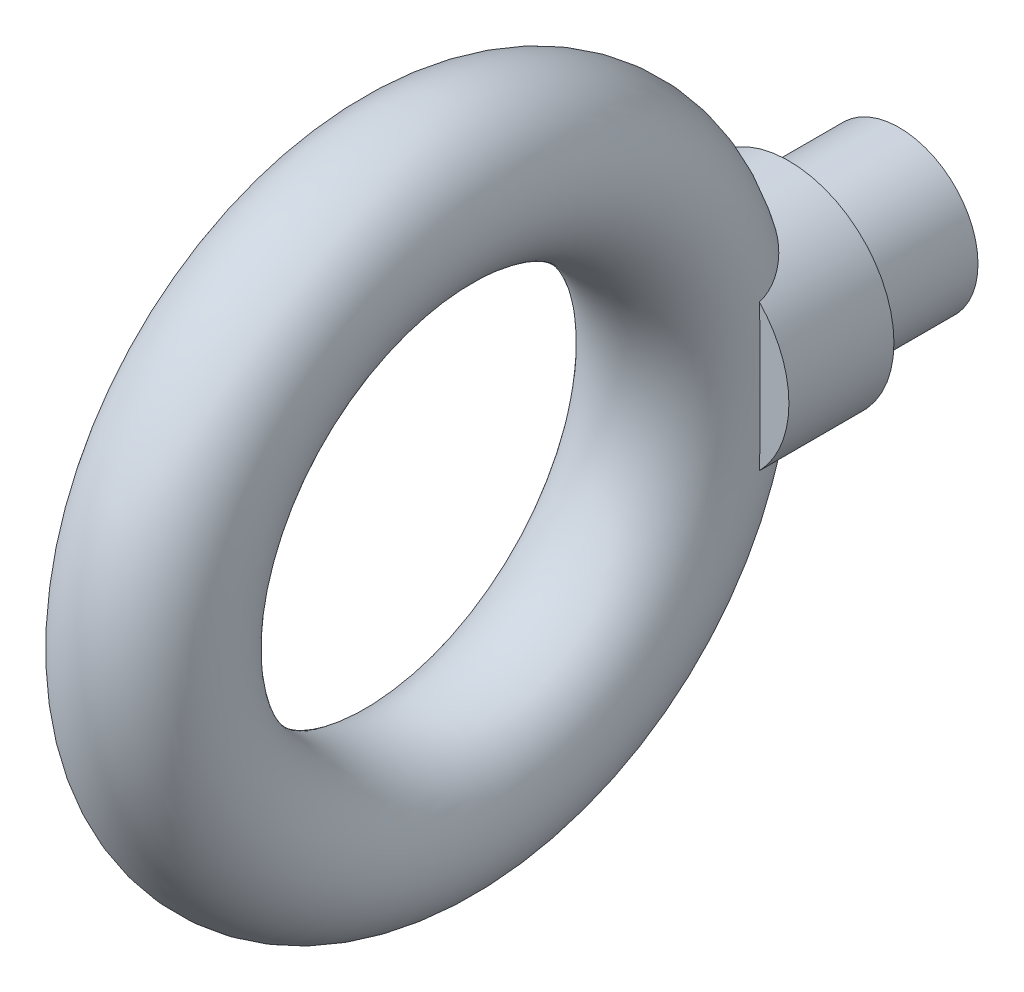
from build123d import *

# Parameters (mm, degrees)
SKETCH_1_R      = 3
EXTRUDE_1_DEPTH = 8.2
SKETCH_3_R      = 2.9
SKETCH_4_R      = 4
EXTRUDE_2_DEPTH = 4


with BuildPart() as part:
    # ｽｹｯﾁ1 → ﾎﾞｽ - 押し出し1 (new body)
    with BuildSketch(Plane.XY):
        Circle(SKETCH_1_R)
    extrude(amount=EXTRUDE_1_DEPTH)

    # ｽｲｰﾌﾟ1: sweep along a path in ｽｹｯﾁ2
    with BuildLine(Plane(origin=(0, 0, 0), x_dir=(0, 0, -1), z_dir=(1, 0, 0))) as sweep_1_path:
        CenterArc((-18.3, 0), 10.1, 0, 360)
    # ｽｹｯﾁ3 → ｽｲｰﾌﾟ1 (sweep)
    with BuildSketch(Plane(origin=(0, 0, 0), x_dir=(1, 0, 0), z_dir=(0, 1, 0))):
        with Locations((0, -8.2)):
            Circle(SKETCH_3_R)
    sweep(path=sweep_1_path.line)

    # ｽｹｯﾁ4 → ﾎﾞｽ - 押し出し2 (add)
    with BuildSketch(Plane.XY.offset(8.2)):
        Circle(SKETCH_4_R)
    extrude(amount=-EXTRUDE_2_DEPTH)


solid = part.part
